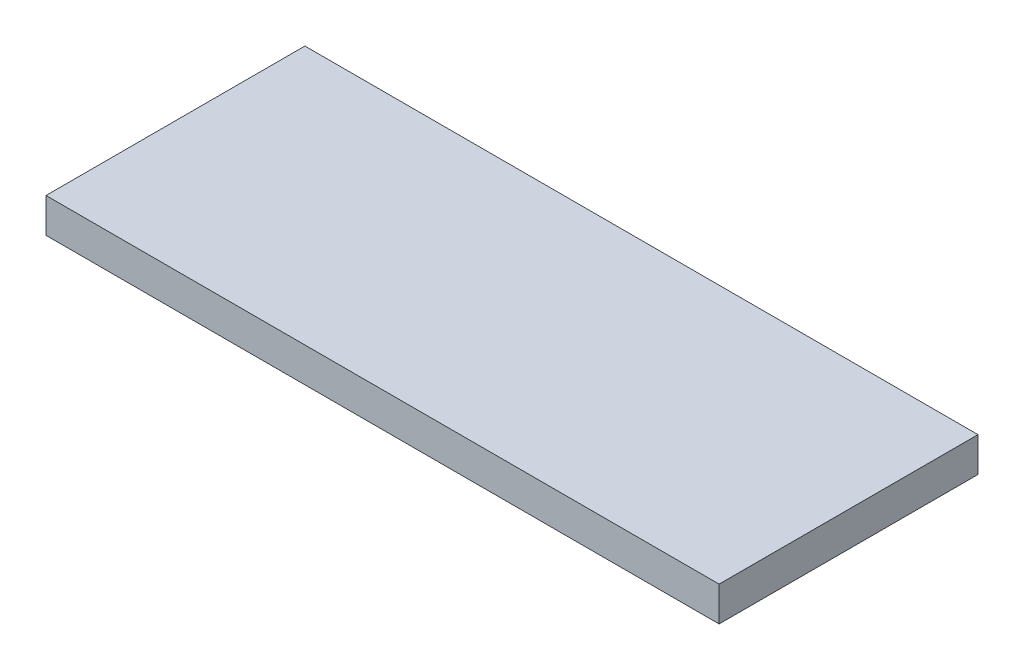
from build123d import *

# Parameters (mm, degrees)
SKETCH_2_W      = 19.5
SKETCH_2_H      = 7.5
EXTRUDE_1_DEPTH = 1


with BuildPart() as part:
    # 草圖2 → 伸長1 (new body)
    with BuildSketch(Plane(origin=(0, 0, 0), x_dir=(1, 0, 0), z_dir=(0, 1, 0))):
        Rectangle(SKETCH_2_W, SKETCH_2_H)
    extrude(amount=EXTRUDE_1_DEPTH)


solid = part.part
